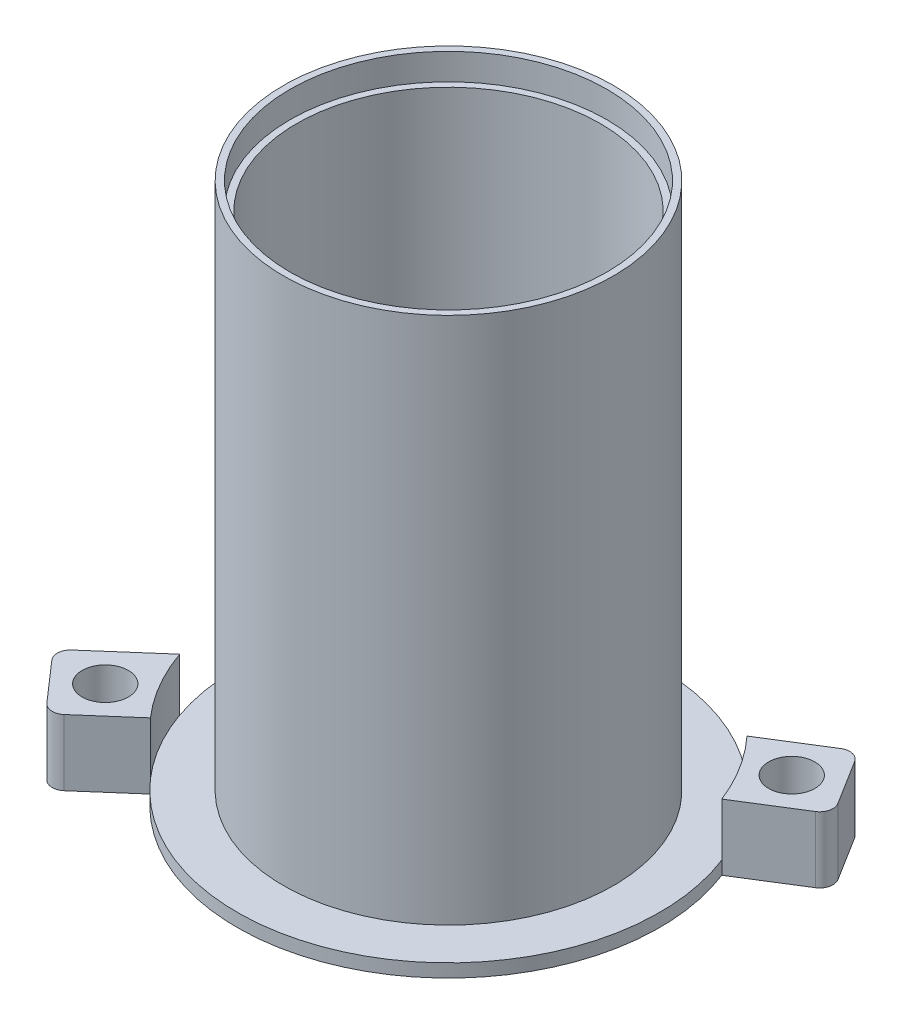
from build123d import *

# Parameters (mm, degrees)
BOSS_EXTRUDE1_START = -5
SKETCH2_R           = 1.75
BOSS_EXTRUDE1_DEPTH = 5
FILLET1_R           = 1


with BuildPart() as part:
    # Sketch1 → Revolve1 (revolve)
    with BuildSketch(Plane.XY, mode=Mode.PRIVATE) as revolve1_sk:
        Polygon((-11.5, 0), (-16, 0), (-16, 1), (-12.5, 1), (-12.5, 41), (-12, 41), (-12, 39), (-11.5, 39), align=None)
    revolve(revolve1_sk.sketch.rotate(Axis((0, 0, 0), (0, 1, 0)), 270), axis=Axis((0, 0, 0), (0, 1, 0)))

    # Sketch2 → Boss-Extrude1 (add)
    # profile 1 of 2: a face of its own
    with BuildSketch(Plane.XZ.offset(BOSS_EXTRUDE1_START)):
        with BuildLine():
            Line((20.133991732, -9.046001908), (14.917336297, -5.785592261))
            ThreePointArc((14.917336297, -5.785592261), (13.567972864, -8.47998304), (11.737342657, -10.873582085))
            Line((11.737342657, -10.873582085), (16.953998092, -14.133991732))
            Line((16.953998092, -14.133991732), (20.133991732, -9.046001908))
        make_face()
        with Locations(Location((16, -10, 0), (0, 0, 270))):
            Circle(SKETCH2_R, mode=Mode.SUBTRACT)
    # profile 2 of 2: a face of its own
    with BuildSketch(Plane.XZ.offset(BOSS_EXTRUDE1_START)):
        with BuildLine():
            Line((-20.233087103, 9.715441438), (-15.116447525, 5.243378132))
            ThreePointArc((-15.116447525, 5.243378132), (-13.836527765, 8.034332543), (-12.047055108, 10.529409443))
            Line((-12.047055108, 10.529409443), (-16.284558562, 14.233087103))
            Line((-16.284558562, 14.233087103), (-20.233087103, 9.715441438))
        make_face()
        with Locations(Location((-16, 10, 0), (0, 0, 270))):
            Circle(SKETCH2_R, mode=Mode.SUBTRACT)
    extrude(amount=BOSS_EXTRUDE1_DEPTH)

    # Fillet1
    fillet1_edges = [part.edges().sort_by_distance(p)[0] for p in [
        (-20.233087103, 2.5, 9.715441438),
        (-16.284558562, 2.5, 14.233087103),
        (16.953998092, 2.5, -14.133991732),
        (20.133991732, 2.5, -9.046001908),
    ]]
    fillet(fillet1_edges, radius=FILLET1_R)


solid = part.part
